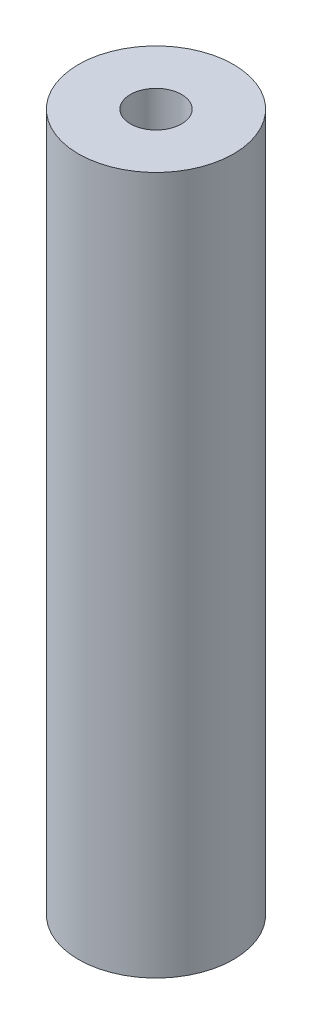
from build123d import *

# Parameters (mm, degrees)
SKETCH_1_R      = 5
EXTRUDE_1_DEPTH = 45


with BuildPart() as part:
    # ｽｹｯﾁ1 → ﾎﾞｽ - 押し出し1 (new body)
    with BuildSketch(Plane(origin=(0, 0, 0), x_dir=(1, 0, 0), z_dir=(0, 1, 0))):
        with Locations(Location((0, 0, 0), (0, 0, 90))):
            Circle(SKETCH_1_R)
    extrude(amount=EXTRUDE_1_DEPTH)

    # ｽｹｯﾁ3 → M4x0.7 ねじ穴1 (revolve, cut)
    with BuildSketch(Plane(origin=(0, 45, 0), x_dir=(0, 0, 1), z_dir=(1, 0, 0))):
        Polygon((0, 0), (0, 15.991420021), (1.65, 15), (1.65, 0), align=None)
    m4x0_7_1 = revolve(axis=Axis((0, 51.35, 0), (0, -1, 0)), mode=Mode.SUBTRACT)

    # ﾐﾗｰ1: M4x0.7 ねじ穴1 across plane
    add(m4x0_7_1.mirror(Plane.ZX.offset(22.5)), mode=Mode.SUBTRACT)


solid = part.part
